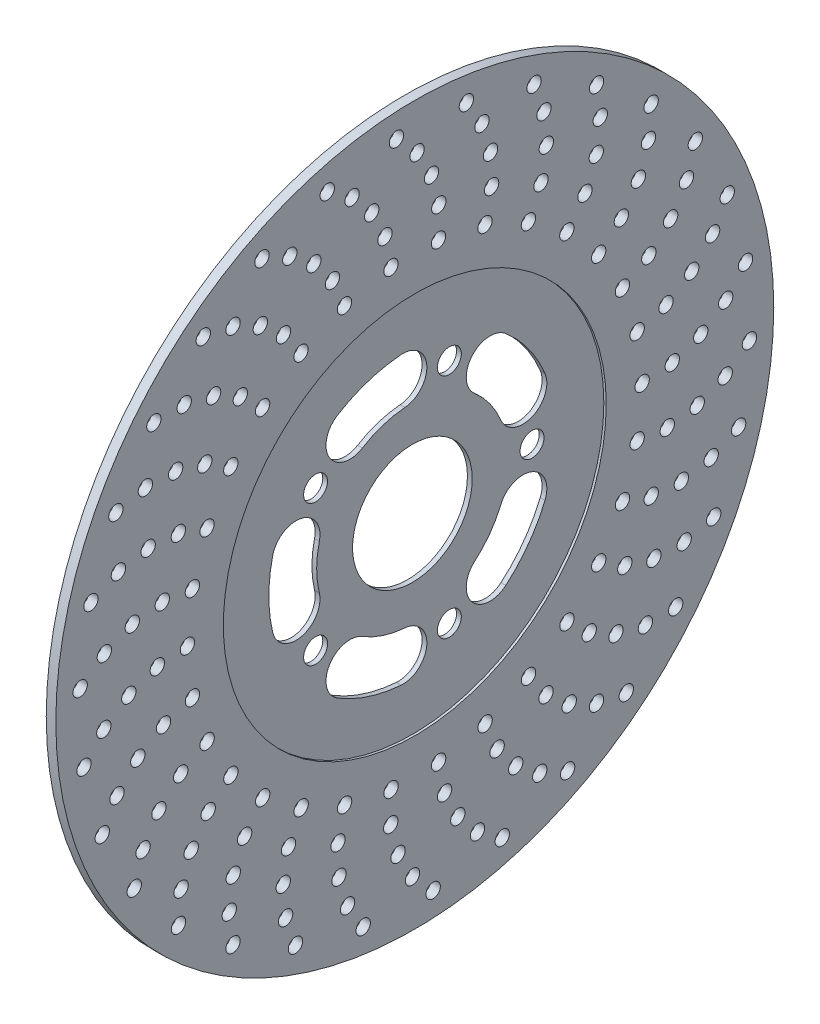
from build123d import *

# Parameters (mm, degrees)
SKETCH1_R           = 150
SKETCH1_R_2         = 80
BOSS_EXTRUDE1_DEPTH = 2
SKETCH1_3_R         = 80
SKETCH1_3_R_2       = 25
BOSS_EXTRUDE2_DEPTH = 1
SKETCH1_4_R         = 5
CUT_EXTRUDE1_DEPTH  = 213.141462237
CIRPATTERN1_COUNT   = 5
SKETCH2_R           = 3
CUT_EXTRUDE2_DEPTH  = 213.169743366
CIRPATTERN2_COUNT   = 30


with BuildPart() as part:
    # Sketch1 → Boss-Extrude1 (new, symmetric)
    with BuildSketch(Plane.YZ):
        Circle(SKETCH1_R)
        Circle(SKETCH1_R_2, mode=Mode.SUBTRACT)
    extrude(amount=BOSS_EXTRUDE1_DEPTH, both=True)

    # Sketch1<3> → Boss-Extrude2 (add, symmetric)
    with BuildSketch(Plane.YZ):
        Circle(SKETCH1_3_R)
        Circle(SKETCH1_3_R_2, mode=Mode.SUBTRACT)
    extrude(amount=BOSS_EXTRUDE2_DEPTH, both=True)

    # Sketch1<4> → Cut-Extrude1 (cut, symmetric)
    with BuildSketch(Plane.YZ):
        with Locations((0, -50)):
            Circle(SKETCH1_4_R)
        with BuildLine():
            ThreePointArc((-9.31272326, 38.900812144), (0, 40), (9.31272326, 38.900812144))
            ThreePointArc((9.31272326, 38.900812144), (21.366107111, 46.297834366), (13.969084889, 58.351218217))
            ThreePointArc((13.969084889, 58.351218217), (0, 60), (-13.969084889, 58.351218217))
            ThreePointArc((-13.969084889, 58.351218217), (-21.366107111, 46.297834366), (-9.31272326, 38.900812144))
        make_face()
    cut_extrude1 = extrude(amount=CUT_EXTRUDE1_DEPTH, both=True, mode=Mode.SUBTRACT)

    # CirPattern1: Cut-Extrude1 ×5 about axis
    cirpattern1_axis = Axis((1, 0, 0), (1, 0, 0))
    for i in range(1, CIRPATTERN1_COUNT):
        add(cut_extrude1.rotate(cirpattern1_axis, i * 360 / CIRPATTERN1_COUNT), mode=Mode.SUBTRACT)

    # Sketch2 → Cut-Extrude2 (cut, symmetric)
    with BuildSketch(Plane.YZ.offset(2)):
        with Locations((-0.026749619, 94.999996234)):
            Circle(SKETCH2_R)
        with Locations((-22.241290169, 138.222013484)):
            Circle(SKETCH2_R)
        with Locations((-12.690971495, 129.922489131)):
            Circle(SKETCH2_R)
        with Locations((-5.529784086, 119.491377676)):
            Circle(SKETCH2_R)
        with Locations((-1.21630372, 107.596648659)):
            Circle(SKETCH2_R)
    cut_extrude2 = extrude(amount=CUT_EXTRUDE2_DEPTH, both=True, mode=Mode.SUBTRACT)

    # CirPattern2: Cut-Extrude2 ×30 about axis
    cirpattern2_axis = Axis((2, 0, 0), (1, 0, 0))
    for i in range(1, CIRPATTERN2_COUNT):
        add(cut_extrude2.rotate(cirpattern2_axis, i * 360 / CIRPATTERN2_COUNT), mode=Mode.SUBTRACT)


solid = part.part
